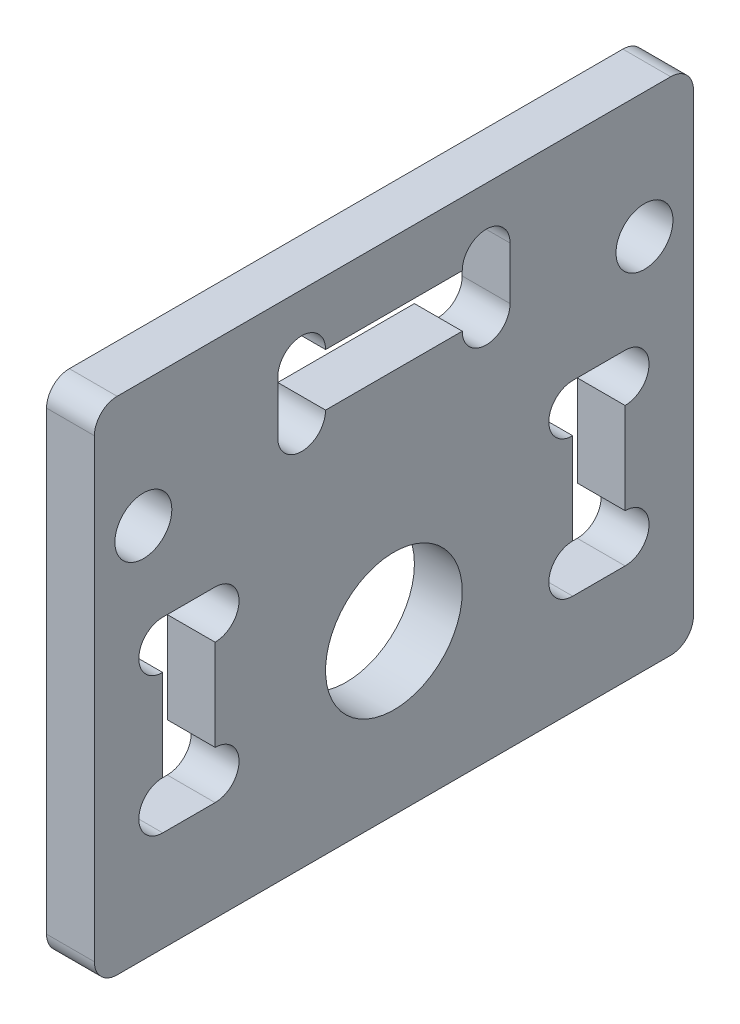
from build123d import *

# Parameters (mm, degrees)
SKETCH_1_W      = 26.3
SKETCH_1_H      = 22
SKETCH_1_R      = 3
SKETCH_1_R_2    = 1.25
EXTRUDE_1_DEPTH = 2.1
FILLET_1_R      = 1


with BuildPart() as part:
    # 草图1 → 凸台-拉伸1 (new body)
    with BuildSketch(Plane(origin=(0, 0, 0), x_dir=(0, 0, -1), z_dir=(1, 0, 0))):
        Rectangle(SKETCH_1_W, SKETCH_1_H)
        with BuildLine():
            ThreePointArc((-6.8, -5.55), (-7.10753788, -6.29246212), (-7.85, -6.6))
            Line((-7.85, -6.6), (-10.15, -6.6))
            ThreePointArc((-10.15, -6.6), (-11.2, -5.55), (-10.15, -4.5))
            Line((-10.15, -4.5), (-10.15, -0.5))
            ThreePointArc((-10.15, -0.5), (-11.2, 0.55), (-10.15, 1.6))
            Line((-10.15, 1.6), (-7.85, 1.6))
            ThreePointArc((-7.85, 1.6), (-7.10753788, 1.29246212), (-6.8, 0.55))
            ThreePointArc((-6.8, 0.55), (-7.10753788, -0.19246212), (-7.85, -0.5))
            Line((-7.85, -0.5), (-7.85, -4.5))
            ThreePointArc((-7.85, -4.5), (-7.10753788, -4.80753788), (-6.8, -5.55))
        make_face(mode=Mode.SUBTRACT)
        with Locations((0, -4)):
            Circle(SKETCH_1_R, mode=Mode.SUBTRACT)
        with BuildLine():
            ThreePointArc((11.2, -5.55), (10.89246212, -6.29246212), (10.15, -6.6))
            Line((10.15, -6.6), (7.85, -6.6))
            ThreePointArc((7.85, -6.6), (6.8, -5.55), (7.85, -4.5))
            Line((7.85, -4.5), (7.85, -0.5))
            ThreePointArc((7.85, -0.5), (6.8, 0.55), (7.85, 1.6))
            Line((7.85, 1.6), (10.15, 1.6))
            ThreePointArc((10.15, 1.6), (10.89246212, 1.29246212), (11.2, 0.55))
            ThreePointArc((11.2, 0.55), (10.89246212, -0.19246212), (10.15, -0.5))
            Line((10.15, -0.5), (10.15, -4.5))
            ThreePointArc((10.15, -4.5), (10.89246212, -4.80753788), (11.2, -5.55))
        make_face(mode=Mode.SUBTRACT)
        with Locations((-11, 5.5)):
            Circle(SKETCH_1_R_2, mode=Mode.SUBTRACT)
        with BuildLine():
            Line((3, 5.9), (-3, 5.9))
            ThreePointArc((-3, 5.9), (-4.05, 4.85), (-5.1, 5.9))
            Line((-5.1, 5.9), (-5.1, 8.2))
            ThreePointArc((-5.1, 8.2), (-4.05, 9.25), (-3, 8.2))
            Line((-3, 8.2), (3, 8.2))
            ThreePointArc((3, 8.2), (4.05, 9.25), (5.1, 8.2))
            Line((5.1, 8.2), (5.1, 5.9))
            ThreePointArc((5.1, 5.9), (4.05, 4.85), (3, 5.9))
        make_face(mode=Mode.SUBTRACT)
        with Locations((11, 5.5)):
            Circle(SKETCH_1_R_2, mode=Mode.SUBTRACT)
    extrude(amount=EXTRUDE_1_DEPTH)

    # 圆角1
    fillet_1_edges = [part.edges().sort_by_distance(p)[0] for p in [
        (1.05, 11, 13.15),
        (1.05, 11, -13.15),
        (1.05, -11, -13.15),
        (1.05, -11, 13.15),
    ]]
    fillet(fillet_1_edges, radius=FILLET_1_R)


solid = part.part
